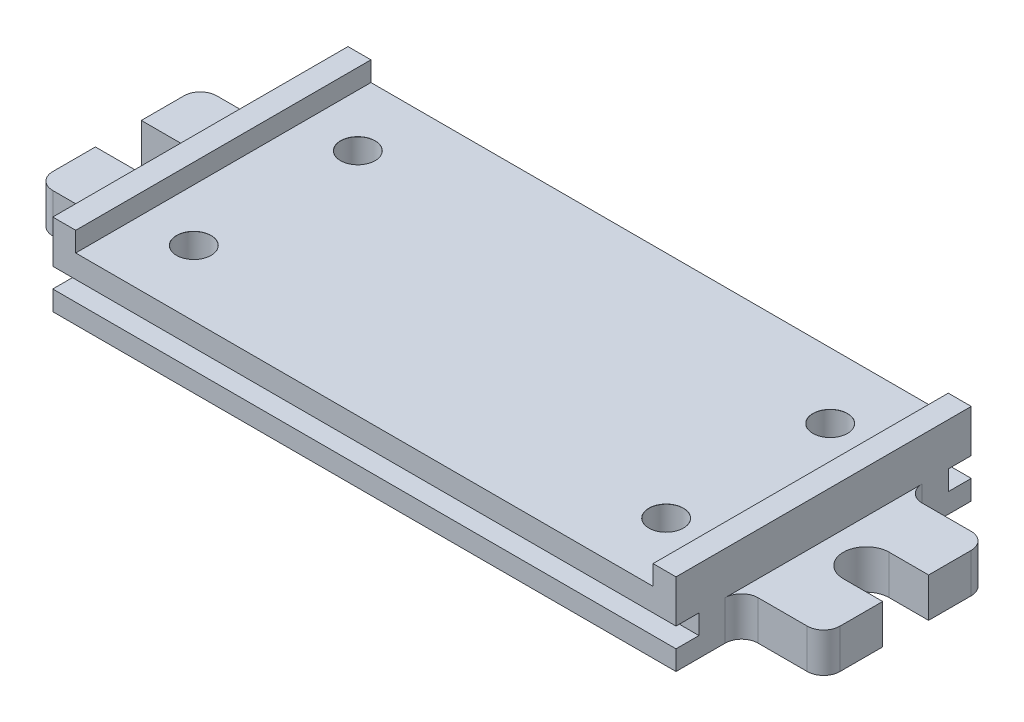
from build123d import *

# Parameters (mm, degrees)
SKETCH1_W                                = 190
SKETCH1_H                                = 90
BOSS_EXTRUDE1_DEPTH                      = 25
BOSS_EXTRUDE2_DEPTH                      = 12
SKETCH2_W                                = 7
SKETCH2_H                                = 6
CUT_EXTRUDE1_DEPTH                       = 222.076909694
SKETCH3_W                                = 176
SKETCH3_H                                = 6
CUT_EXTRUDE2_DEPTH                       = 153.069063257
CUT_EXTRUDE3_DEPTH                       = 6
HOLE_FOR_M8_300_SC_NUTS_SP_1_D           = 10.5
HOLE_FOR_M8_300_SC_NUTS_SP_1_CSINK_D     = 10.55
HOLE_FOR_M8_300_SC_NUTS_SP_1_CSINK_ANGLE = 90
SKETCH7_W                                = 1.329700855
SKETCH7_H                                = 7.408333333
BOSS_EXTRUDE3_DEPTH                      = 5


with BuildPart() as part:
    # Sketch1 → Boss-Extrude1 (new body)
    with BuildSketch(Plane(origin=(0, 0, 0), x_dir=(1, 0, 0), z_dir=(0, 1, 0))):
        Rectangle(SKETCH1_W, SKETCH1_H)
    extrude(amount=BOSS_EXTRUDE1_DEPTH)

    # Sketch1<3> → Boss-Extrude2 (add)
    with BuildSketch(Plane(origin=(0, 0, 0), x_dir=(1, 0, 0), z_dir=(0, 1, 0))):
        with BuildLine():
            ThreePointArc((-95, 30), (-96.464466094, 26.464466094), (-100, 25))
            Line((-100, 25), (-115, 25))
            ThreePointArc((-115, 25), (-118.535533906, 23.535533906), (-120, 20))
            Line((-120, 20), (-120, 7))
            Line((-120, 7), (-108, 7))
            ThreePointArc((-108, 7), (-101, 0), (-108, -7))
            Line((-108, -7), (-120, -7))
            Line((-120, -7), (-120, -20))
            ThreePointArc((-120, -20), (-118.535533906, -23.535533906), (-115, -25))
            Line((-115, -25), (-100, -25))
            ThreePointArc((-100, -25), (-96.464466094, -26.464466094), (-95, -30))
            Line((-95, -30), (-95, 30))
        make_face()
        with BuildLine():
            ThreePointArc((100, 25), (96.464466094, 26.464466094), (95, 30))
            Line((95, 30), (95, -30))
            ThreePointArc((95, -30), (96.464466094, -26.464466094), (100, -25))
            Line((100, -25), (115, -25))
            ThreePointArc((115, -25), (118.535533906, -23.535533906), (120, -20))
            Line((120, -20), (120, -7))
            Line((120, -7), (108, -7))
            ThreePointArc((108, -7), (101, 0), (108, 7))
            Line((108, 7), (120, 7))
            Line((120, 7), (120, 20))
            ThreePointArc((120, 20), (118.535533906, 23.535533906), (115, 25))
            Line((115, 25), (100, 25))
        make_face()
    extrude(amount=BOSS_EXTRUDE2_DEPTH)

    # Sketch2 → Cut-Extrude1 (cut, through all)
    with BuildSketch(Plane.ZY.offset(95)):
        with Locations((-41.5, 9)):
            Rectangle(SKETCH2_W, SKETCH2_H)
        with Locations((41.5, 9)):
            Rectangle(SKETCH2_W, SKETCH2_H)
    extrude(amount=-CUT_EXTRUDE1_DEPTH, mode=Mode.SUBTRACT)

    # Sketch3 → Cut-Extrude2 (cut, through all)
    with BuildSketch(Plane(origin=(0, 0, -45), x_dir=(-1, 0, 0), z_dir=(0, 0, -1))):
        with Locations((0, 22)):
            Rectangle(SKETCH3_W, SKETCH3_H)
    extrude(amount=-CUT_EXTRUDE2_DEPTH, mode=Mode.SUBTRACT)

    # Sketch4 → Cut-Extrude3 (cut)
    with BuildSketch(Plane.XZ):
        with BuildLine():
            Line((-77, -30), (77, -30))
            ThreePointArc((77, -30), (80.535533906, -28.535533906), (82, -25))
            Line((82, -25), (82, 25))
            ThreePointArc((82, 25), (80.535533906, 28.535533906), (77, 30))
            Line((77, 30), (-77, 30))
            ThreePointArc((-77, 30), (-80.535533906, 28.535533906), (-82, 25))
            Line((-82, 25), (-82, -25))
            ThreePointArc((-82, -25), (-80.535533906, -28.535533906), (-77, -30))
        make_face()
    extrude(amount=-CUT_EXTRUDE3_DEPTH, mode=Mode.SUBTRACT)

    # Hole for M8 300® SC Nuts (SP)1 (through all)
    with Locations(Plane(origin=(0, 19, 0), x_dir=(1, 0, 0), z_dir=(0, 1, 0))):
        with Locations((-72, 25), (-72, -25), (72, -25), (72, 25)):
            CounterSinkHole(HOLE_FOR_M8_300_SC_NUTS_SP_1_D / 2, HOLE_FOR_M8_300_SC_NUTS_SP_1_CSINK_D / 2, counter_sink_angle=HOLE_FOR_M8_300_SC_NUTS_SP_1_CSINK_ANGLE)

    # Sketch7 → Boss-Extrude3 (add)
    # profile 1 of 26: a face of its own
    with BuildSketch(Plane.XZ.offset(-6)):
        Polygon((-51.969907661, 7.742094723), (-50.733701398, 7.742094723), (-47.741874475, 0.33376139), (-49.162101839, 0.33376139), (-49.737909798, 1.853419509), (-52.962731179, 1.853419509), (-53.54002318, 0.33376139), (-54.960250543, 0.33376139), align=None)
        Polygon((-51.351062509, 5.754963646), (-52.458157194, 3.183120364), (-50.242483783, 3.183120364), align=None, mode=Mode.SUBTRACT)
    # profile 2 of 26: a face of its own
    with BuildSketch(Plane.XZ.offset(-6)):
        Polygon((-46.649620201, 7.742094723), (-45.319919347, 7.742094723), (-45.319919347, 5.134634453), (-43.218517103, 7.742094723), (-41.540066582, 7.742094723), (-44.180175757, 4.465331902), (-41.283327466, 0.33376139), (-42.884607848, 0.33376139), (-45.319919347, 3.807901681), (-45.319919347, 0.33376139), (-46.649620201, 0.33376139), align=None)
    # profile 3 of 26: a face of its own
    with BuildSketch(Plane.XZ.offset(-6)):
        Polygon((-38.008048687, 7.742094723), (-36.771842424, 7.742094723), (-33.780015501, 0.33376139), (-35.200242864, 0.33376139), (-35.776050824, 1.853419509), (-39.000872205, 1.853419509), (-39.578164205, 0.33376139), (-40.998391569, 0.33376139), align=None)
        Polygon((-37.389203535, 5.754963646), (-38.49629822, 3.183120364), (-36.280624809, 3.183120364), align=None, mode=Mode.SUBTRACT)
    # profile 4 of 26: a face of its own
    with BuildSketch(Plane.XZ.offset(-6)):
        with BuildLine():
            Line((-28.888615928, 6.752239287), (-29.882923487, 5.842522073))
            add(Edge.make_bspline(
                [(-29.882923487, 5.842522073), (-29.925515359, 5.902602337), (-30.007285814, 6.017948065), (-30.139827193, 6.172398714), (-30.27177008, 6.304156611), (-30.404336845, 6.412671333), (-30.53870251, 6.497283573), (-30.674633835, 6.557189974), (-30.811360188, 6.595273041), (-30.903219192, 6.600015299), (-30.94846502, 6.602351133)],
                knots=[0, 0, 0, 0, 1.299362458, 2.494594718, 3.587462134, 4.587049575, 5.512617175, 6.380583204, 7.202344345, 8, 8, 8, 8], degree=3))
            add(Edge.make_bspline(
                [(-30.94846502, 6.602351133), (-30.99066903, 6.600871041), (-31.072153886, 6.598013373), (-31.188316594, 6.569608365), (-31.291447499, 6.520585492), (-31.381445953, 6.456483962), (-31.452738006, 6.379256479), (-31.509659182, 6.298264706), (-31.541710587, 6.208868106), (-31.545929182, 6.147466915), (-31.548017637, 6.117069683)],
                knots=[0, 0, 0, 0, 1.185010067, 2.2879431, 3.333075148, 4.379039566, 5.372662701, 6.27520591, 7.14612461, 8, 8, 8, 8], degree=3))
            add(Edge.make_bspline(
                [(-31.548017637, 6.117069683), (-31.546708908, 6.086234109), (-31.54407331, 6.024135549), (-31.51861702, 5.933122375), (-31.480247122, 5.84419191), (-31.443583117, 5.790055704), (-31.424842223, 5.762383852)],
                knots=[0, 0, 0, 0, 0.967525499, 1.948461899, 2.951351359, 4, 4, 4, 4], degree=3))
            add(Edge.make_bspline(
                [(-31.424842223, 5.762383852), (-31.407804723, 5.740874811), (-31.368586648, 5.691363839), (-31.293805812, 5.612946178), (-31.199896786, 5.516877678), (-31.083245755, 5.406461855), (-30.948695222, 5.277727723), (-30.790008598, 5.135735871), (-30.611753575, 4.976088975), (-30.485054035, 4.864916657), (-30.418662336, 4.806661363)],
                knots=[0, 0, 0, 0, 0.473873513, 1.090794244, 1.870441696, 2.795289791, 3.865433203, 5.087734844, 6.473946851, 8, 8, 8, 8], degree=3))
            add(Edge.make_bspline(
                [(-30.418662336, 4.806661363), (-30.356344175, 4.752728139), (-30.238077254, 4.650374084), (-30.069806912, 4.505098937), (-29.921925305, 4.37439843), (-29.792278138, 4.260234097), (-29.682830735, 4.161408094), (-29.593122978, 4.077448033), (-29.522059239, 4.009988461), (-29.481663665, 3.969242839), (-29.464423887, 3.951853671)],
                knots=[0, 0, 0, 0, 1.543621617, 2.929473131, 4.163658386, 5.240097082, 6.164993805, 6.925417477, 7.541396219, 8, 8, 8, 8], degree=3))
            add(Edge.make_bspline(
                [(-29.464423887, 3.951853671), (-29.399019767, 3.881072405), (-29.273290078, 3.745005954), (-29.109885806, 3.534145749), (-28.975398804, 3.328303192), (-28.871357109, 3.123605024), (-28.792780637, 2.917097857), (-28.737383183, 2.703717114), (-28.704205279, 2.481233099), (-28.700521757, 2.329414919), (-28.698658663, 2.252626574)],
                knots=[0, 0, 0, 0, 1.206664779, 2.319633467, 3.337109185, 4.282041471, 5.190008762, 6.099243693, 7.03861361, 8, 8, 8, 8], degree=3))
            add(Edge.make_bspline(
                [(-28.698658663, 2.252626574), (-28.699984766, 2.177805748), (-28.702586628, 2.031004504), (-28.734454458, 1.816182751), (-28.779896113, 1.610589009), (-28.850156884, 1.41646043), (-28.935790295, 1.230610452), (-29.043144143, 1.055934026), (-29.169216518, 0.890663357), (-29.313714817, 0.737752859), (-29.473547094, 0.598997181), (-29.644982401, 0.475473599), (-29.829697119, 0.373489148), (-30.026113075, 0.289512227), (-30.234125131, 0.22483208), (-30.453485483, 0.177027423), (-30.684529657, 0.148335821), (-30.842520992, 0.145336455), (-30.923236321, 0.143804125)],
                knots=[0, 0, 0, 0, 1.043214005, 2.046824704, 3.02475056, 3.976699089, 4.921714032, 5.875962561, 6.831408892, 7.817874052, 8.806269674, 9.781291748, 10.760897367, 11.74438705, 12.757449933, 13.795994037, 14.874007457, 16, 16, 16, 16], degree=3))
            add(Edge.make_bspline(
                [(-30.923236321, 0.143804125), (-30.986597166, 0.144928188), (-31.112087978, 0.147154479), (-31.297042463, 0.165330288), (-31.475636925, 0.194664111), (-31.647670196, 0.236708243), (-31.813917314, 0.289983859), (-31.974385107, 0.355057984), (-32.127965814, 0.432939241), (-32.275821497, 0.522026083), (-32.417233397, 0.625467641), (-32.553989611, 0.741149087), (-32.684731747, 0.870849653), (-32.810087732, 1.014262602), (-32.929255503, 1.171794045), (-33.046135851, 1.341250066), (-33.15553426, 1.525775537), (-33.223114524, 1.655221648), (-33.257633022, 1.721339848)],
                knots=[0, 0, 0, 0, 1.016823716, 2.013894106, 2.979844003, 3.91962641, 4.853723003, 5.779685073, 6.695824784, 7.614987388, 8.547259901, 9.504950863, 10.487499108, 11.500346958, 12.559593716, 13.656357062, 14.802919212, 16, 16, 16, 16], degree=3))
            Line((-33.257633022, 1.721339848), (-32.08820861, 2.423291304))
            add(Edge.make_bspline(
                [(-32.08820861, 2.423291304), (-32.045031127, 2.348238508), (-31.962256203, 2.204355884), (-31.821986356, 2.011031343), (-31.678287058, 1.845480874), (-31.527836111, 1.710630593), (-31.372462942, 1.604677379), (-31.211417062, 1.528955861), (-31.044585324, 1.482084327), (-30.930947124, 1.476360231), (-30.874262963, 1.473504979)],
                knots=[0, 0, 0, 0, 1.283663364, 2.460892379, 3.537111102, 4.529833553, 5.449777664, 6.316464042, 7.160231139, 8, 8, 8, 8], degree=3))
            add(Edge.make_bspline(
                [(-30.874262963, 1.473504979), (-30.816607057, 1.475836732), (-30.704746201, 1.480360673), (-30.545079144, 1.522146948), (-30.39869034, 1.587754464), (-30.272152939, 1.681367344), (-30.165009046, 1.789410835), (-30.085930703, 1.909614159), (-30.036253155, 2.039671254), (-30.031001034, 2.130017467), (-30.028359518, 2.175456435)],
                knots=[0, 0, 0, 0, 1.13588714, 2.203786484, 3.234766741, 4.283437687, 5.291419208, 6.222934724, 7.106237994, 8, 8, 8, 8], degree=3))
            add(Edge.make_bspline(
                [(-30.028359518, 2.175456435), (-30.03079885, 2.217730001), (-30.035754119, 2.303604702), (-30.072253106, 2.431286575), (-30.129312155, 2.55891038), (-30.196817034, 2.663590878), (-30.265511701, 2.751237021), (-30.331199297, 2.82717844), (-30.411189412, 2.911080412), (-30.505279226, 3.003048481), (-30.612225569, 3.103892265), (-30.732118528, 3.213601888), (-30.866331004, 3.33121094), (-30.961192647, 3.411325064), (-31.010794747, 3.45321585)],
                knots=[0, 0, 0, 0, 0.916159276, 1.861089862, 2.860218735, 3.940849679, 4.552606315, 5.27541173, 6.11797699, 7.06649574, 8.129236253, 9.306560635, 10.591630461, 12, 12, 12, 12], degree=3))
            add(Edge.make_bspline(
                [(-31.010794747, 3.45321585), (-31.105090314, 3.532998941), (-31.286072046, 3.686126842), (-31.541822196, 3.912291931), (-31.772275981, 4.123663929), (-31.975442954, 4.322855858), (-32.153911776, 4.506189103), (-32.306473781, 4.675152768), (-32.431453003, 4.831050176), (-32.562966686, 5.015700223), (-32.68793098, 5.240708993), (-32.795935591, 5.511420627), (-32.866004424, 5.782097913), (-32.873854662, 5.963815733), (-32.877718492, 6.053255914)],
                knots=[0, 0, 0, 0, 1.345494975, 2.582412109, 3.71882943, 4.751509156, 5.681369928, 6.505683931, 7.230279997, 7.856715994, 8.973648664, 10.023341002, 11.027102913, 12, 12, 12, 12], degree=3))
            add(Edge.make_bspline(
                [(-32.877718492, 6.053255914), (-32.87611153, 6.11668209), (-32.872945643, 6.241638469), (-32.844705442, 6.425368618), (-32.802499386, 6.602652774), (-32.741204074, 6.772844124), (-32.661650162, 6.935729497), (-32.565035025, 7.092106284), (-32.449858414, 7.240535229), (-32.320062149, 7.380917934), (-32.177059896, 7.509211751), (-32.024243817, 7.6224439), (-31.862478862, 7.71808142), (-31.692754629, 7.797419686), (-31.514019406, 7.85814809), (-31.327589929, 7.901195409), (-31.133198798, 7.926798581), (-31.000978146, 7.930279036), (-30.933624609, 7.932051988)],
                knots=[0, 0, 0, 0, 1.010766082, 1.991317756, 2.957454644, 3.913069143, 4.869106762, 5.843196583, 6.838735724, 7.860187025, 8.887984031, 9.89767229, 10.887916223, 11.879572884, 12.879850636, 13.892031539, 14.926195476, 16, 16, 16, 16], degree=3))
            add(Edge.make_bspline(
                [(-30.933624609, 7.932051988), (-30.846337757, 7.928858849), (-30.672453066, 7.922497776), (-30.415359535, 7.872756268), (-30.164241322, 7.794532507), (-29.961885561, 7.700164146), (-29.800874858, 7.608749469), (-29.677475196, 7.52458635), (-29.551909396, 7.428172974), (-29.423164851, 7.319205517), (-29.293633831, 7.195630888), (-29.159633152, 7.060390879), (-29.022988737, 6.912316701), (-28.934191532, 6.806533194), (-28.888615928, 6.752239287)],
                knots=[0, 0, 0, 0, 1.282922637, 2.555718331, 3.837320111, 5.142675274, 5.830281639, 6.55870424, 7.337177975, 8.157850921, 9.037902056, 9.96903443, 10.957596896, 12, 12, 12, 12], degree=3))
        make_face()
    # profile 5 of 26: a face of its own
    with BuildSketch(Plane.XZ.offset(-6)):
        Polygon((-27.368957808, 7.742094723), (-26.039256954, 7.742094723), (-26.039256954, 4.892735749), (-23.474833877, 4.892735749), (-23.474833877, 7.742094723), (-22.145133022, 7.742094723), (-22.145133022, 0.33376139), (-23.474833877, 0.33376139), (-23.474833877, 3.563034894), (-26.039256954, 3.563034894), (-26.039256954, 0.33376139), (-27.368957808, 0.33376139), align=None)
    # profile 6 of 26: a face of its own
    with BuildSketch(Plane.XZ.offset(-6)):
        with BuildLine():
            Line((-20.435517637, 7.742094723), (-18.760035199, 7.742094723))
            add(Edge.make_bspline(
                [(-18.760035199, 7.742094723), (-18.629412071, 7.741181623), (-18.376916089, 7.739416589), (-18.011099363, 7.719528908), (-17.670936358, 7.688943067), (-17.3562078, 7.646866699), (-17.067558932, 7.591188142), (-16.805361961, 7.521350305), (-16.568736892, 7.44073414), (-16.35508918, 7.345872864), (-16.160049368, 7.235274037), (-15.974852841, 7.112075822), (-15.79986323, 6.971765111), (-15.63262483, 6.817048774), (-15.475295891, 6.645096326), (-15.32525632, 6.458755921), (-15.186179767, 6.255325366), (-15.05386225, 6.039682285), (-14.934198662, 5.810912803), (-14.82982361, 5.570964157), (-14.742387995, 5.321380508), (-14.671342031, 5.061895863), (-14.614710198, 4.793371632), (-14.575086045, 4.51526596), (-14.55059, 4.227836325), (-14.548105081, 4.033031148), (-14.546842424, 3.934045177)],
                knots=[0, 0, 0, 0, 1.44355588, 2.790409838, 4.047694926, 5.217575253, 6.298404546, 7.294384826, 8.214239204, 9.058592145, 9.873746385, 10.689560431, 11.514393297, 12.350027578, 13.205127629, 14.088021785, 14.991911688, 15.926770944, 16.882954281, 17.842803888, 18.816321264, 19.80318086, 20.814351908, 21.847355356, 22.906180909, 24, 24, 24, 24], degree=3))
            add(Edge.make_bspline(
                [(-14.546842424, 3.934045177), (-14.550148741, 3.794369528), (-14.556657421, 3.519409837), (-14.611482906, 3.115909659), (-14.700154277, 2.729114494), (-14.82483428, 2.362050003), (-14.979404107, 2.017984951), (-15.164055074, 1.702986779), (-15.376079767, 1.418746239), (-15.613008088, 1.166678616), (-15.869543754, 0.950023077), (-16.136136043, 0.764473463), (-16.415382048, 0.61815211), (-16.661436805, 0.525362491), (-16.874796975, 0.467655376), (-17.062124897, 0.433549915), (-17.274910303, 0.40227315), (-17.515137231, 0.37810314), (-17.781751858, 0.35654943), (-18.075816914, 0.344837983), (-18.3963803, 0.335107509), (-18.619041881, 0.334221853), (-18.7348065, 0.33376139)],
                knots=[0, 0, 0, 0, 1.315458931, 2.589557908, 3.828601765, 5.048913369, 6.235739168, 7.376350998, 8.481830359, 9.569842114, 10.627874879, 11.640079404, 12.624025415, 13.590060155, 14.111227486, 14.704434459, 15.382649715, 16.137166398, 16.978595427, 17.902333227, 18.909396075, 20, 20, 20, 20], degree=3))
            Line((-18.7348065, 0.33376139), (-20.435517637, 0.33376139))
            Line((-20.435517637, 0.33376139), (-20.435517637, 7.742094723))
        make_face()
        with BuildLine():
            Line((-19.105816783, 6.412393868), (-19.105816783, 1.663462244))
            Line((-19.105816783, 1.663462244), (-18.411285533, 1.663462244))
            add(Edge.make_bspline(
                [(-18.411285533, 1.663462244), (-18.32864698, 1.663613672), (-18.169705533, 1.663904919), (-17.940230062, 1.677777243), (-17.728023437, 1.69170123), (-17.533669812, 1.718129424), (-17.355754743, 1.747568573), (-17.196722317, 1.788537179), (-17.053294183, 1.83157123), (-16.927222291, 1.886358909), (-16.811750709, 1.948026089), (-16.704837214, 2.02027634), (-16.601635758, 2.100507518), (-16.504075775, 2.191079338), (-16.411788024, 2.290792457), (-16.325318539, 2.400160653), (-16.243513179, 2.518850242), (-16.168471735, 2.647488763), (-16.099898461, 2.784717765), (-16.039066284, 2.929207986), (-15.988627432, 3.082162717), (-15.946705746, 3.242150119), (-15.916747948, 3.410563063), (-15.891963584, 3.586154138), (-15.879186523, 3.76961902), (-15.877432951, 3.894454658), (-15.876543278, 3.957789835)],
                knots=[0, 0, 0, 0, 1.50275155, 2.890291501, 4.180787663, 5.369391935, 6.45668281, 7.458360028, 8.354766181, 9.177074746, 9.954075863, 10.732690366, 11.5210699, 12.329727389, 13.151100085, 13.990027547, 14.863562427, 15.770965086, 16.696477834, 17.652329173, 18.619756807, 19.62365428, 20.657822005, 21.729286259, 22.847956731, 24, 24, 24, 24], degree=3))
            add(Edge.make_bspline(
                [(-15.876543278, 3.957789835), (-15.878315203, 4.054845006), (-15.88177032, 4.24409507), (-15.915090715, 4.519741918), (-15.969329963, 4.77930472), (-16.046724143, 5.021820167), (-16.144281906, 5.247969857), (-16.266398188, 5.455837821), (-16.407817574, 5.648915955), (-16.519648166, 5.762181784), (-16.575526652, 5.818777415)],
                knots=[0, 0, 0, 0, 1.13821349, 2.219428113, 3.251817212, 4.244760574, 5.201143372, 6.134805572, 7.068016741, 8, 8, 8, 8], degree=3))
            add(Edge.make_bspline(
                [(-16.575526652, 5.818777415), (-16.630628129, 5.867004544), (-16.743166658, 5.965502994), (-16.940747333, 6.083529327), (-17.158471003, 6.187227028), (-17.401318535, 6.269447741), (-17.666942913, 6.334471386), (-17.956926202, 6.379316604), (-18.26971548, 6.408133665), (-18.486408604, 6.410943377), (-18.598274715, 6.412393868)],
                knots=[0, 0, 0, 0, 0.813307809, 1.661089106, 2.549956539, 3.493439533, 4.508053171, 5.589449661, 6.755572447, 8, 8, 8, 8], degree=3))
            Line((-18.598274715, 6.412393868), (-19.105816783, 6.412393868))
        make_face(mode=Mode.SUBTRACT)
    # profile 7 of 26: a face of its own
    with BuildSketch(Plane.XZ.offset(-6)):
        with Locations((-12.742248406, 4.037928057)):
            Rectangle(SKETCH7_W, SKETCH7_H)
    # profile 8 of 26: a face of its own
    with BuildSketch(Plane.XZ.offset(-6)):
        with BuildLine():
            Line((-10.367782595, 7.742094723), (-8.883741462, 7.742094723))
            add(Edge.make_bspline(
                [(-8.883741462, 7.742094723), (-8.78677614, 7.741660685), (-8.599709708, 7.740823336), (-8.329944522, 7.730669364), (-8.08107293, 7.712472827), (-7.853152109, 7.689984784), (-7.646275775, 7.658457424), (-7.460184856, 7.622313774), (-7.294840735, 7.578280289), (-7.14837891, 7.526013152), (-7.016934152, 7.46439224), (-6.892545017, 7.398761571), (-6.778022712, 7.320433681), (-6.667586951, 7.237850419), (-6.567551536, 7.143122637), (-6.47167566, 7.042554606), (-6.384019926, 6.932157882), (-6.304178172, 6.813268786), (-6.231749399, 6.688083881), (-6.168470777, 6.556379374), (-6.117142702, 6.417946855), (-6.07408483, 6.273681826), (-6.039500328, 6.123590574), (-6.016479782, 5.966750025), (-6.000843069, 5.804255299), (-5.999463345, 5.693661286), (-5.998765501, 5.637724397)],
                knots=[0, 0, 0, 0, 1.698747864, 3.27724071, 4.728299578, 6.070144658, 7.288476769, 8.393259625, 9.389771311, 10.283485332, 11.113357557, 11.931608583, 12.74405601, 13.541433047, 14.344816069, 15.154114104, 15.974336324, 16.810834471, 17.661136416, 18.50621059, 19.367396281, 20.244825668, 21.142564693, 22.063065223, 23.020325768, 24, 24, 24, 24], degree=3))
            add(Edge.make_bspline(
                [(-5.998765501, 5.637724397), (-5.999775195, 5.575842749), (-6.001759368, 5.454237706), (-6.021210659, 5.275979633), (-6.05443961, 5.106026699), (-6.09786811, 4.942945661), (-6.158426065, 4.789419564), (-6.227610686, 4.641785228), (-6.312729713, 4.504181867), (-6.40999181, 4.374888228), (-6.516213116, 4.252853092), (-6.63391532, 4.141599994), (-6.760854967, 4.040370526), (-6.89629725, 3.948103794), (-7.040750659, 3.86498592), (-7.194110965, 3.790238596), (-7.357425398, 3.72625247), (-7.471152655, 3.692788245), (-7.528811908, 3.67582202)],
                knots=[0, 0, 0, 0, 1.102006807, 2.165578795, 3.188629044, 4.184801286, 5.166646146, 6.124351954, 7.085497154, 8.042432466, 9.003981491, 9.963833307, 10.922997304, 11.89326795, 12.880200226, 13.889073926, 14.929769137, 16, 16, 16, 16], degree=3))
            add(Edge.make_bspline(
                [(-7.528811908, 3.67582202), (-7.566789609, 3.666373106), (-7.649061539, 3.645903717), (-7.785198985, 3.625122149), (-7.942083099, 3.606014776), (-8.120221188, 3.589594301), (-8.319715954, 3.578432204), (-8.540374233, 3.569715103), (-8.782296025, 3.563376871), (-8.950518872, 3.563151962), (-9.03808174, 3.563034894)],
                knots=[0, 0, 0, 0, 0.618981996, 1.340914327, 2.176866532, 3.120127938, 4.170906482, 5.338178032, 6.614476169, 8, 8, 8, 8], degree=3))
            Line((-9.03808174, 3.563034894), (-9.03808174, 0.33376139))
            Line((-9.03808174, 0.33376139), (-10.367782595, 0.33376139))
            Line((-10.367782595, 0.33376139), (-10.367782595, 7.742094723))
        make_face()
        with BuildLine():
            Line((-9.03808174, 4.892735749), (-8.567640701, 4.892735749))
            add(Edge.make_bspline(
                [(-8.567640701, 4.892735749), (-8.482036527, 4.893278545), (-8.324523574, 4.8942773), (-8.109416504, 4.908719869), (-7.936552325, 4.930776588), (-7.799986414, 4.962411026), (-7.692154691, 5.010420473), (-7.599156582, 5.065958363), (-7.519389729, 5.1361845), (-7.450323375, 5.216429877), (-7.395106907, 5.308635838), (-7.356817162, 5.411300987), (-7.331944896, 5.52226822), (-7.329647712, 5.599494069), (-7.328466355, 5.639208438)],
                knots=[0, 0, 0, 0, 1.8619151, 3.425951444, 4.686033666, 5.651700536, 6.461346321, 7.243864085, 7.999046032, 8.762387399, 9.539336099, 10.322741239, 11.137448474, 12, 12, 12, 12], degree=3))
            add(Edge.make_bspline(
                [(-7.328466355, 5.639208438), (-7.32963556, 5.673906365), (-7.331904097, 5.741228687), (-7.348569393, 5.838391496), (-7.375129081, 5.928967277), (-7.413613047, 6.012010087), (-7.463363702, 6.087378823), (-7.524019819, 6.155043794), (-7.594803061, 6.216454103), (-7.649451861, 6.248959517), (-7.677216021, 6.265473796)],
                knots=[0, 0, 0, 0, 1.102301479, 2.1387299, 3.123554645, 4.094223062, 5.036071848, 5.982632524, 6.975082478, 8, 8, 8, 8], degree=3))
            add(Edge.make_bspline(
                [(-7.677216021, 6.265473796), (-7.700733868, 6.277367445), (-7.750525967, 6.302548738), (-7.835326741, 6.331823832), (-7.933185538, 6.356520598), (-8.044763017, 6.377018676), (-8.169614062, 6.392927313), (-8.307716399, 6.405093441), (-8.459273258, 6.409985915), (-8.564671984, 6.411569079), (-8.619582141, 6.412393868)],
                knots=[0, 0, 0, 0, 0.656809284, 1.390599849, 2.23162475, 3.173112763, 4.218524733, 5.370385145, 6.63003504, 8, 8, 8, 8], degree=3))
            Line((-8.619582141, 6.412393868), (-9.03808174, 6.412393868))
            Line((-9.03808174, 6.412393868), (-9.03808174, 4.892735749))
        make_face(mode=Mode.SUBTRACT)
    # profile 9 of 26: a face of its own
    with BuildSketch(Plane.XZ.offset(-6)):
        Polygon((-1.233509424, 7.742094723), (0.143680747, 7.742094723), (1.836971679, 2.5746635), (3.539166858, 7.742094723), (4.905968741, 7.742094723), (6.158499457, 0.33376139), (4.81247415, 0.33376139), (4.021480226, 5.01294308), (2.48104553, 0.33376139), (1.185477622, 0.33376139), (-0.347536868, 5.01294308), (-1.137046751, 0.33376139), (-2.484556099, 0.33376139), align=None)
    # profile 10 of 26: a face of its own
    with BuildSketch(Plane.XZ.offset(-6)):
        Polygon((9.671224817, 7.742094723), (10.907431081, 7.742094723), (13.899258004, 0.33376139), (12.47903064, 0.33376139), (11.90322268, 1.853419509), (8.6784013, 1.853419509), (8.101109299, 0.33376139), (6.680881935, 0.33376139), align=None)
        Polygon((10.290069969, 5.754963646), (9.182975285, 3.183120364), (11.398648695, 3.183120364), align=None, mode=Mode.SUBTRACT)
    # profile 11 of 26: a face of its own
    with BuildSketch(Plane.XZ.offset(-6)):
        Polygon((14.991512277, 7.742094723), (16.321213132, 7.742094723), (16.321213132, 4.892735749), (18.885636209, 4.892735749), (18.885636209, 7.742094723), (20.215337063, 7.742094723), (20.215337063, 0.33376139), (18.885636209, 0.33376139), (18.885636209, 3.563034894), (16.321213132, 3.563034894), (16.321213132, 0.33376139), (14.991512277, 0.33376139), align=None)
    # profile 12 of 26: a face of its own
    with BuildSketch(Plane.XZ.offset(-6)):
        Polygon((24.202955586, 7.742094723), (25.43916185, 7.742094723), (28.430988773, 0.33376139), (27.010761409, 0.33376139), (26.43495345, 1.853419509), (23.210132069, 1.853419509), (22.632840068, 0.33376139), (21.212612705, 0.33376139), align=None)
        Polygon((24.821800739, 5.754963646), (23.714706054, 3.183120364), (25.930379465, 3.183120364), align=None, mode=Mode.SUBTRACT)
    # profile 13 of 26: a face of its own
    with BuildSketch(Plane.XZ.offset(-6)):
        with BuildLine():
            Line((29.523243046, 7.742094723), (31.007284179, 7.742094723))
            add(Edge.make_bspline(
                [(31.007284179, 7.742094723), (31.104249501, 7.741660685), (31.291315933, 7.740823336), (31.561081119, 7.730669364), (31.809952711, 7.712472827), (32.037873532, 7.689984784), (32.244749866, 7.658457424), (32.430840785, 7.622313774), (32.596184906, 7.578280289), (32.742646732, 7.526013152), (32.874091489, 7.46439224), (32.998480624, 7.398761571), (33.113002929, 7.320433681), (33.22343869, 7.237850419), (33.323474105, 7.143122637), (33.419349982, 7.042554606), (33.507005715, 6.932157882), (33.586847469, 6.813268786), (33.659276242, 6.688083881), (33.722554864, 6.556379374), (33.773882939, 6.417946855), (33.816940811, 6.273681826), (33.851525313, 6.123590574), (33.874545859, 5.966750025), (33.890182572, 5.804255299), (33.891562296, 5.693661286), (33.89226014, 5.637724397)],
                knots=[0, 0, 0, 0, 1.698747864, 3.27724071, 4.728299578, 6.070144658, 7.288476769, 8.393259625, 9.389771311, 10.283485332, 11.113357557, 11.931608583, 12.74405601, 13.541433047, 14.344816069, 15.154114104, 15.974336324, 16.810834471, 17.661136416, 18.50621059, 19.367396281, 20.244825668, 21.142564693, 22.063065223, 23.020325768, 24, 24, 24, 24], degree=3))
            add(Edge.make_bspline(
                [(33.89226014, 5.637724397), (33.891250446, 5.575842749), (33.889266273, 5.454237706), (33.869814982, 5.275979633), (33.836586031, 5.106026699), (33.793157531, 4.942945661), (33.732599576, 4.789419564), (33.663414955, 4.641785228), (33.578295928, 4.504181867), (33.481033831, 4.374888228), (33.374812525, 4.252853092), (33.257110322, 4.141599994), (33.130170674, 4.040370526), (32.994728391, 3.948103794), (32.850274982, 3.86498592), (32.696914676, 3.790238596), (32.533600243, 3.72625247), (32.419872986, 3.692788245), (32.362213733, 3.67582202)],
                knots=[0, 0, 0, 0, 1.102006807, 2.165578795, 3.188629044, 4.184801286, 5.166646146, 6.124351954, 7.085497154, 8.042432466, 9.003981491, 9.963833307, 10.922997304, 11.89326795, 12.880200226, 13.889073926, 14.929769137, 16, 16, 16, 16], degree=3))
            add(Edge.make_bspline(
                [(32.362213733, 3.67582202), (32.324236032, 3.666373106), (32.241964102, 3.645903717), (32.105826656, 3.625122149), (31.948942542, 3.606014776), (31.770804453, 3.589594301), (31.571309687, 3.578432204), (31.350651408, 3.569715103), (31.108729616, 3.563376871), (30.940506769, 3.563151962), (30.852943901, 3.563034894)],
                knots=[0, 0, 0, 0, 0.618981996, 1.340914327, 2.176866532, 3.120127938, 4.170906482, 5.338178032, 6.614476169, 8, 8, 8, 8], degree=3))
            Line((30.852943901, 3.563034894), (30.852943901, 0.33376139))
            Line((30.852943901, 0.33376139), (29.523243046, 0.33376139))
            Line((29.523243046, 0.33376139), (29.523243046, 7.742094723))
        make_face()
        with BuildLine():
            Line((30.852943901, 4.892735749), (31.32338494, 4.892735749))
            add(Edge.make_bspline(
                [(31.32338494, 4.892735749), (31.408989114, 4.893278545), (31.566502067, 4.8942773), (31.781609137, 4.908719869), (31.954473316, 4.930776588), (32.091039227, 4.962411026), (32.19887095, 5.010420473), (32.291869059, 5.065958363), (32.371635912, 5.1361845), (32.440702266, 5.216429877), (32.495918734, 5.308635838), (32.534208479, 5.411300987), (32.559080745, 5.52226822), (32.561377929, 5.599494069), (32.562559286, 5.639208438)],
                knots=[0, 0, 0, 0, 1.8619151, 3.425951444, 4.686033666, 5.651700536, 6.461346321, 7.243864085, 7.999046032, 8.762387399, 9.539336099, 10.322741239, 11.137448474, 12, 12, 12, 12], degree=3))
            add(Edge.make_bspline(
                [(32.562559286, 5.639208438), (32.561390081, 5.673906365), (32.559121544, 5.741228687), (32.542456248, 5.838391496), (32.51589656, 5.928967277), (32.477412594, 6.012010087), (32.427661939, 6.087378823), (32.367005822, 6.155043794), (32.29622258, 6.216454103), (32.24157378, 6.248959517), (32.21380962, 6.265473796)],
                knots=[0, 0, 0, 0, 1.102301479, 2.1387299, 3.123554645, 4.094223062, 5.036071848, 5.982632524, 6.975082478, 8, 8, 8, 8], degree=3))
            add(Edge.make_bspline(
                [(32.21380962, 6.265473796), (32.190291773, 6.277367445), (32.140499674, 6.302548738), (32.0556989, 6.331823832), (31.957840103, 6.356520598), (31.846262624, 6.377018676), (31.721411579, 6.392927313), (31.583309242, 6.405093441), (31.431752383, 6.409985915), (31.326353657, 6.411569079), (31.2714435, 6.412393868)],
                knots=[0, 0, 0, 0, 0.656809284, 1.390599849, 2.23162475, 3.173112763, 4.218524733, 5.370385145, 6.63003504, 8, 8, 8, 8], degree=3))
            Line((31.2714435, 6.412393868), (30.852943901, 6.412393868))
            Line((30.852943901, 6.412393868), (30.852943901, 4.892735749))
        make_face(mode=Mode.SUBTRACT)
    # profile 14 of 26: a face of its own
    with BuildSketch(Plane.XZ.offset(-6)):
        Polygon((37.499964133, 7.742094723), (38.736170397, 7.742094723), (41.72799732, 0.33376139), (40.307769956, 0.33376139), (39.731961997, 1.853419509), (36.507140616, 1.853419509), (35.929848615, 0.33376139), (34.509621252, 0.33376139), align=None)
        Polygon((38.118809286, 5.754963646), (37.011714601, 3.183120364), (39.227388012, 3.183120364), align=None, mode=Mode.SUBTRACT)
    # profile 15 of 26: a face of its own
    with BuildSketch(Plane.XZ.offset(-6)):
        Polygon((42.060422534, 7.742094723), (46.049525098, 7.742094723), (46.049525098, 6.412393868), (44.719824243, 6.412393868), (44.719824243, 0.33376139), (43.390123388, 0.33376139), (43.390123388, 6.412393868), (42.060422534, 6.412393868), align=None)
    # profile 16 of 26: a face of its own
    with BuildSketch(Plane.XZ.offset(-6)):
        with BuildLine():
            Line((47.094290055, 7.742094723), (48.643628997, 7.742094723))
            add(Edge.make_bspline(
                [(48.643628997, 7.742094723), (48.74603983, 7.741731223), (48.943004708, 7.741032111), (49.227017305, 7.730001971), (49.487921933, 7.714652626), (49.726104886, 7.691229118), (49.941464264, 7.660172378), (50.134215908, 7.623561621), (50.304354185, 7.581835814), (50.453313976, 7.529842166), (50.587742821, 7.47119412), (50.713049193, 7.40380644), (50.831997539, 7.328429508), (50.943792816, 7.243079954), (51.049406551, 7.149293195), (51.149037992, 7.046974826), (51.241279253, 6.935257229), (51.325559174, 6.814846317), (51.402373537, 6.688176799), (51.470261324, 6.555074757), (51.525467785, 6.415447626), (51.574248611, 6.271313322), (51.60938386, 6.120611416), (51.633819912, 5.964809016), (51.651711033, 5.803357681), (51.652739686, 5.693674812), (51.653264414, 5.637724397)],
                knots=[0, 0, 0, 0, 1.749336639, 3.364467119, 4.854658419, 6.213483162, 7.451590619, 8.570285859, 9.5643256, 10.440900261, 11.26203566, 12.067320669, 12.869050712, 13.665104639, 14.467235401, 15.27997916, 16.102287765, 16.939272006, 17.78853747, 18.631303466, 19.488103222, 20.351255419, 21.228522269, 22.127379805, 23.044756219, 24, 24, 24, 24], degree=3))
            add(Edge.make_bspline(
                [(51.653264414, 5.637724397), (51.651901361, 5.579325016), (51.649228662, 5.464814475), (51.634832051, 5.296607828), (51.608519568, 5.135679475), (51.568665485, 4.982500592), (51.522858393, 4.835164691), (51.461946712, 4.69639021), (51.393201858, 4.564158877), (51.311555605, 4.440341153), (51.22195283, 4.322186799), (51.117746688, 4.214222748), (51.005688136, 4.110646339), (50.879477955, 4.017945248), (50.744679606, 3.929851362), (50.598614788, 3.850014842), (50.442236771, 3.776428779), (50.332295281, 3.735392108), (50.276074243, 3.714407089)],
                knots=[0, 0, 0, 0, 1.099860209, 2.156625411, 3.176576793, 4.16617041, 5.135385252, 6.078461593, 7.016046972, 7.938469504, 8.868247731, 9.803980173, 10.76021508, 11.73834243, 12.748633912, 13.790971185, 14.870363756, 16, 16, 16, 16], degree=3))
            Line((50.276074243, 3.714407089), (51.985689628, 0.33376139))
            Line((51.985689628, 0.33376139), (50.50758466, 0.33376139))
            Line((50.50758466, 0.33376139), (48.875139414, 3.563034894))
            Line((48.875139414, 3.563034894), (48.42399091, 3.563034894))
            Line((48.42399091, 3.563034894), (48.42399091, 0.33376139))
            Line((48.42399091, 0.33376139), (47.094290055, 0.33376139))
            Line((47.094290055, 0.33376139), (47.094290055, 7.742094723))
        make_face()
        with BuildLine():
            Line((48.42399091, 4.892735749), (48.941921265, 4.892735749))
            add(Edge.make_bspline(
                [(48.941921265, 4.892735749), (49.005242556, 4.893448915), (49.126489223, 4.894814477), (49.300857854, 4.901148517), (49.459226156, 4.916410424), (49.602274216, 4.935693272), (49.730721837, 4.957958106), (49.843423314, 4.989864964), (49.942115204, 5.02405397), (50.025628003, 5.066542036), (50.09697942, 5.114860182), (50.158586802, 5.169750798), (50.20954494, 5.233279695), (50.251486087, 5.303720434), (50.28411174, 5.381696046), (50.307925966, 5.466350533), (50.321234598, 5.558648221), (50.322765801, 5.622346194), (50.323563559, 5.655532891)],
                knots=[0, 0, 0, 0, 1.688639943, 3.233382647, 4.650958383, 5.928841754, 7.082724185, 8.122798841, 9.049171256, 9.863274652, 10.613301712, 11.341792392, 12.054588806, 12.776240173, 13.521029143, 14.301969904, 15.115324896, 16, 16, 16, 16], degree=3))
            add(Edge.make_bspline(
                [(50.323563559, 5.655532891), (50.322055324, 5.694795176), (50.319092676, 5.771918659), (50.289694002, 5.882949433), (50.242897663, 5.985716011), (50.178752699, 6.079754067), (50.097970456, 6.162194319), (50.00526646, 6.234866058), (49.898639933, 6.292329431), (49.799911792, 6.330231661), (49.710092262, 6.352908955), (49.629032969, 6.369807875), (49.53516582, 6.381784624), (49.42841995, 6.394488099), (49.309067458, 6.402725659), (49.176457802, 6.408737436), (49.030971835, 6.411197149), (48.929554298, 6.411983476), (48.876623455, 6.412393868)],
                knots=[0, 0, 0, 0, 1.020303359, 2.004196876, 2.966617323, 3.9489082, 4.950758222, 5.960522915, 7.003732012, 8.091992268, 8.70421221, 9.413913587, 10.24622431, 11.166358409, 12.212345909, 13.359657661, 14.621978493, 16, 16, 16, 16], degree=3))
            Line((48.876623455, 6.412393868), (48.42399091, 6.412393868))
            Line((48.42399091, 6.412393868), (48.42399091, 4.892735749))
        make_face(mode=Mode.SUBTRACT)
    # profile 17 of 26: a face of its own
    with BuildSketch(Plane.XZ.offset(-6)):
        Polygon((55.355947039, 7.742094723), (56.592153303, 7.742094723), (59.583980226, 0.33376139), (58.163752862, 0.33376139), (57.587944903, 1.853419509), (54.363123522, 1.853419509), (53.785831521, 0.33376139), (52.365604158, 0.33376139), align=None)
        Polygon((55.974792192, 5.754963646), (54.867697507, 3.183120364), (57.083370918, 3.183120364), align=None, mode=Mode.SUBTRACT)
    # profile 18 of 26: a face of its own
    with BuildSketch(Plane.XZ.offset(-6)):
        Polygon((-22.707156318, -6.941939782), (-21.435227065, -6.941939782), (-21.435227065, -13.821106449), (-22.052588176, -13.821106449), (-22.052588176, -7.647495338), (-23.110921509, -7.647495338), align=None)
    # profile 19 of 26: a face of its own
    with BuildSketch(Plane.XZ.offset(-6)):
        with BuildLine():
            Line((-17.995643731, -9.058606449), (-18.613004842, -9.058606449))
            add(Edge.make_bspline(
                [(-18.613004842, -9.058606449), (-18.608981212, -8.976703311), (-18.601078909, -8.815847728), (-18.564072354, -8.581319431), (-18.511120702, -8.35714744), (-18.436252856, -8.145131692), (-18.343273493, -7.943397561), (-18.231771975, -7.752746339), (-18.099704062, -7.573905324), (-17.94992154, -7.408532431), (-17.787241751, -7.256822098), (-17.611713053, -7.125812806), (-17.427262887, -7.015121764), (-17.234450854, -6.922584704), (-17.031101579, -6.853125078), (-16.819060391, -6.80158707), (-16.597395683, -6.770579038), (-16.44636845, -6.767246012), (-16.369558662, -6.765550893)],
                knots=[0, 0, 0, 0, 1.10065271, 2.161652631, 3.183658789, 4.190468796, 5.17591951, 6.163126047, 7.15150782, 8.156236427, 9.156009102, 10.134482811, 11.092018607, 12.041330605, 13.001268258, 13.972401359, 14.968799086, 16, 16, 16, 16], degree=3))
            add(Edge.make_bspline(
                [(-16.369558662, -6.765550893), (-16.294127471, -6.767316788), (-16.145907875, -6.770786708), (-15.929583607, -6.80058535), (-15.723646329, -6.847256745), (-15.528498588, -6.912737403), (-15.345697382, -7.000760128), (-15.17386947, -7.10649791), (-15.01096921, -7.228789507), (-14.864331353, -7.372768133), (-14.729680354, -7.526473058), (-14.613516279, -7.690566545), (-14.514037311, -7.860048153), (-14.431118431, -8.036210249), (-14.370078329, -8.22071152), (-14.323735923, -8.410865844), (-14.297541208, -8.608641514), (-14.293520977, -8.742503327), (-14.291477065, -8.810559574)],
                knots=[0, 0, 0, 0, 1.111607364, 2.184268762, 3.212621178, 4.221274766, 5.211760367, 6.196651075, 7.1921475, 8.207485113, 9.220403448, 10.201281604, 11.166441695, 12.114753415, 13.065576456, 14.026450734, 14.996634279, 16, 16, 16, 16], degree=3))
            add(Edge.make_bspline(
                [(-14.291477065, -8.810559574), (-14.294792125, -8.906376163), (-14.301364071, -9.096327896), (-14.358079268, -9.375827175), (-14.445704318, -9.646876286), (-14.551983569, -9.865002971), (-14.659338995, -10.039884935), (-14.754035236, -10.185164368), (-14.867349563, -10.340095813), (-14.998245193, -10.506239695), (-15.144747476, -10.684104224), (-15.307910829, -10.87376239), (-15.48898168, -11.073199859), (-15.616065797, -11.209418784), (-15.681917603, -11.280004018)],
                knots=[0, 0, 0, 0, 1.184203166, 2.347625244, 3.513805382, 4.700623107, 5.337941753, 6.051866363, 6.845199593, 7.711357327, 8.668078039, 9.695487809, 10.805859518, 12, 12, 12, 12], degree=3))
            Line((-15.681917603, -11.280004018), (-17.403087308, -13.115550893))
            Line((-17.403087308, -13.115550893), (-14.20328262, -13.115550893))
            Line((-14.20328262, -13.115550893), (-14.20328262, -13.821106449))
            Line((-14.20328262, -13.821106449), (-18.877588176, -13.821106449))
            Line((-18.877588176, -13.821106449), (-16.209706231, -10.974079539))
            add(Edge.make_bspline(
                [(-16.209706231, -10.974079539), (-16.144751397, -10.906273939), (-16.019986453, -10.776033258), (-15.843520935, -10.585887273), (-15.685026924, -10.409486688), (-15.543478453, -10.247164793), (-15.421946171, -10.096547271), (-15.314096105, -9.962512205), (-15.227682783, -9.839169827), (-15.133899309, -9.696199882), (-15.043066829, -9.521641387), (-14.965013138, -9.308321005), (-14.91741943, -9.08872375), (-14.911710045, -8.940326294), (-14.908838176, -8.865681102)],
                knots=[0, 0, 0, 0, 1.329631726, 2.553950428, 3.673215718, 4.687767853, 5.603093632, 6.413772471, 7.123043292, 7.734684054, 8.834405432, 9.900288307, 10.943827018, 12, 12, 12, 12], degree=3))
            add(Edge.make_bspline(
                [(-14.908838176, -8.865681102), (-14.910087712, -8.818742782), (-14.912550308, -8.726236366), (-14.934283949, -8.59060719), (-14.967128051, -8.459775633), (-15.014191886, -8.333339264), (-15.076314181, -8.212569298), (-15.151932693, -8.097318727), (-15.239180306, -7.985897915), (-15.340110003, -7.881426374), (-15.450985502, -7.785744623), (-15.568116581, -7.70098526), (-15.692040059, -7.630151246), (-15.822233442, -7.572084206), (-15.958333764, -7.526533546), (-16.100604257, -7.49497079), (-16.248651818, -7.475153908), (-16.349743129, -7.472472661), (-16.40125354, -7.471106449)],
                knots=[0, 0, 0, 0, 0.991446411, 1.95395049, 2.89581595, 3.838931463, 4.798493298, 5.75982156, 6.748411868, 7.785213223, 8.824556874, 9.840280684, 10.836137867, 11.835679398, 12.848801643, 13.863922112, 14.911575587, 16, 16, 16, 16], degree=3))
            add(Edge.make_bspline(
                [(-16.40125354, -7.471106449), (-16.45505026, -7.472511828), (-16.560698136, -7.47527176), (-16.715811616, -7.494577972), (-16.863784019, -7.527884618), (-17.004987569, -7.57343782), (-17.139661184, -7.631337896), (-17.267149918, -7.703454646), (-17.387167573, -7.78951006), (-17.499939763, -7.887077391), (-17.603842655, -7.995704546), (-17.695132884, -8.116797461), (-17.774899798, -8.248145155), (-17.844495803, -8.389393218), (-17.901014427, -8.541823326), (-17.944202131, -8.704894374), (-17.978375564, -8.877898304), (-17.989792073, -8.997369941), (-17.995643731, -9.058606449)],
                knots=[0, 0, 0, 0, 1.031018746, 2.02475058, 2.990194455, 3.934040569, 4.864654155, 5.795059489, 6.735614925, 7.690564532, 8.649604399, 9.611025574, 10.590972636, 11.591080095, 12.624614302, 13.701020113, 14.821632451, 16, 16, 16, 16], degree=3))
        make_face()
    # profile 20 of 26: a face of its own
    with BuildSketch(Plane.XZ.offset(-6)):
        Polygon((-9.969949287, -6.765550893), (-12.847293037, -14.791245338), (-13.497727065, -14.791245338), (-10.620383315, -6.765550893), align=None)
    # profile 21 of 26: a face of its own
    with BuildSketch(Plane.XZ.offset(-6)):
        with BuildLine():
            Line((-2.473421509, -6.941939782), (-2.473421509, -7.647495338))
            Line((-2.473421509, -7.647495338), (-4.811952325, -7.647495338))
            Line((-4.811952325, -7.647495338), (-5.184022637, -9.456859487))
            add(Edge.make_bspline(
                [(-5.184022637, -9.456859487), (-5.111190199, -9.436752131), (-4.970088868, -9.39779731), (-4.761827284, -9.354545492), (-4.564115703, -9.328472578), (-4.435818517, -9.32491249), (-4.373736179, -9.323189782)],
                knots=[0, 0, 0, 0, 1.100273476, 2.13160584, 3.095893838, 4, 4, 4, 4], degree=3))
            add(Edge.make_bspline(
                [(-4.373736179, -9.323189782), (-4.296918019, -9.324852449), (-4.145874324, -9.328121666), (-3.924878251, -9.359513956), (-3.713918005, -9.40892586), (-3.513434775, -9.477954409), (-3.323057669, -9.56622342), (-3.144538259, -9.676486517), (-2.975196933, -9.805290719), (-2.818071668, -9.953379547), (-2.675526867, -10.11636001), (-2.550196332, -10.291597683), (-2.443741051, -10.477389552), (-2.358123424, -10.675510748), (-2.289755643, -10.883770942), (-2.244250949, -11.10436141), (-2.213949774, -11.335202894), (-2.210564465, -11.493039614), (-2.208838176, -11.573526154)],
                knots=[0, 0, 0, 0, 1.052922333, 2.070308379, 3.05430497, 4.020497103, 4.973039431, 5.925935799, 6.892292201, 7.88610001, 8.88166317, 9.857072816, 10.836096531, 11.812156883, 12.81219415, 13.836441305, 14.89672472, 16, 16, 16, 16], degree=3))
            add(Edge.make_bspline(
                [(-2.208838176, -11.573526154), (-2.210145365, -11.629585899), (-2.212742079, -11.74094779), (-2.225947303, -11.906331213), (-2.251372145, -12.0682134), (-2.285507993, -12.226615827), (-2.329814579, -12.381238605), (-2.383450565, -12.532524311), (-2.449089662, -12.67953133), (-2.521087757, -12.823650648), (-2.602156728, -12.961624142), (-2.692133294, -13.090655662), (-2.787194516, -13.212680839), (-2.88948062, -13.326390974), (-2.999942337, -13.431038858), (-3.117241891, -13.52724554), (-3.240443283, -13.616638012), (-3.371452575, -13.695587643), (-3.507350479, -13.768237453), (-3.65009951, -13.827837644), (-3.796450244, -13.881122741), (-3.948509065, -13.923595753), (-4.105931547, -13.956876286), (-4.268977183, -13.979480443), (-4.436790857, -13.995944131), (-4.550542816, -13.996974742), (-4.608002672, -13.997495338)],
                knots=[0, 0, 0, 0, 1.056347294, 2.098418968, 3.122841568, 4.141288669, 5.149314143, 6.15115421, 7.162517403, 8.180376062, 9.185164535, 10.17417709, 11.141909838, 12.097768115, 13.052685741, 14.0056014, 14.954263652, 15.917497458, 16.885230207, 17.854509472, 18.828990115, 19.81800267, 20.826176721, 21.857883937, 22.917946725, 24, 24, 24, 24], degree=3))
            add(Edge.make_bspline(
                [(-4.608002672, -13.997495338), (-4.676547044, -13.996137512), (-4.811399998, -13.993466151), (-5.008970779, -13.965520056), (-5.199061034, -13.925495264), (-5.380140554, -13.865280405), (-5.553832169, -13.789831091), (-5.717797535, -13.694473711), (-5.876226268, -13.586413592), (-6.022677902, -13.458892803), (-6.158602597, -13.319509718), (-6.280278366, -13.168251307), (-6.388642099, -13.007614034), (-6.48195848, -12.836817781), (-6.561556376, -12.656311335), (-6.624087978, -12.46541839), (-6.674558174, -12.265136358), (-6.695909968, -12.127251304), (-6.706754842, -12.05721756)],
                knots=[0, 0, 0, 0, 1.0467383, 2.05933395, 3.04377827, 4.011590433, 4.970194871, 5.932262533, 6.905835911, 7.896367577, 8.894135286, 9.877477877, 10.858688626, 11.851381753, 12.8477658, 13.868841284, 14.917554742, 16, 16, 16, 16], degree=3))
            Line((-6.706754842, -12.05721756), (-6.089393731, -12.05721756))
            add(Edge.make_bspline(
                [(-6.089393731, -12.05721756), (-6.074203436, -12.122818183), (-6.045006844, -12.248906222), (-5.980921021, -12.426057227), (-5.902565592, -12.583922749), (-5.809393474, -12.724591061), (-5.698245736, -12.847254459), (-5.57141468, -12.95656847), (-5.429216952, -13.055186492), (-5.271205974, -13.137388145), (-5.104507886, -13.207494231), (-4.930038048, -13.254177622), (-4.752547005, -13.287002829), (-4.632498923, -13.290288635), (-4.572173679, -13.291939782)],
                knots=[0, 0, 0, 0, 1.136247022, 2.183929868, 3.172523383, 4.106158343, 5.02341133, 5.958108904, 6.928429099, 7.938127109, 8.96079061, 9.975095812, 10.982467395, 12, 12, 12, 12], degree=3))
            add(Edge.make_bspline(
                [(-4.572173679, -13.291939782), (-4.51329107, -13.290326563), (-4.397350731, -13.28715012), (-4.226725017, -13.262701538), (-4.061992808, -13.225047788), (-3.904779563, -13.168697871), (-3.752334204, -13.100211406), (-3.6085129, -13.012324989), (-3.469154983, -12.911181548), (-3.338592068, -12.795303696), (-3.21901358, -12.667607308), (-3.113357203, -12.531051145), (-3.025349246, -12.385376248), (-2.951183754, -12.233104611), (-2.894866377, -12.072567351), (-2.854690115, -11.904516827), (-2.831098389, -11.728537956), (-2.827853034, -11.608507681), (-2.826199287, -11.547343428)],
                knots=[0, 0, 0, 0, 1.027316725, 2.022795036, 3.002884548, 3.971462791, 4.93288096, 5.914575861, 6.907176829, 7.935150275, 8.956128384, 9.956726525, 10.942570165, 11.921478529, 12.907843606, 13.90538589, 14.932640048, 16, 16, 16, 16], degree=3))
            add(Edge.make_bspline(
                [(-2.826199287, -11.547343428), (-2.827493512, -11.492161207), (-2.830026775, -11.38414986), (-2.85072436, -11.226127134), (-2.886725933, -11.076607381), (-2.936695964, -10.934868571), (-3.000140568, -10.800777019), (-3.077671356, -10.674194338), (-3.170743332, -10.556788911), (-3.277059651, -10.448505808), (-3.39352992, -10.348571417), (-3.522158037, -10.263379647), (-3.660252251, -10.191710686), (-3.806148761, -10.129861084), (-3.963317865, -10.085439857), (-4.128647103, -10.052089882), (-4.3039218, -10.032798021), (-4.423758236, -10.030121261), (-4.485357273, -10.028745338)],
                knots=[0, 0, 0, 0, 1.045622112, 2.046656509, 3.013763289, 3.955457236, 4.890082067, 5.820317437, 6.762574623, 7.722996705, 8.69280354, 9.665887285, 10.63943826, 11.638615906, 12.663482002, 13.728887084, 14.832589034, 16, 16, 16, 16], degree=3))
            add(Edge.make_bspline(
                [(-4.485357273, -10.028745338), (-4.538678537, -10.029886476), (-4.648773418, -10.032242636), (-4.817652688, -10.049590906), (-4.99511892, -10.0775779), (-5.180491816, -10.116074203), (-5.374328076, -10.166451474), (-5.576218647, -10.226820094), (-5.786588019, -10.298996308), (-5.928333689, -10.353503314), (-6.001199287, -10.381523115)],
                knots=[0, 0, 0, 0, 0.817624296, 1.688186739, 2.600797293, 3.572016777, 4.590301741, 5.671205678, 6.80286297, 8, 8, 8, 8], degree=3))
            Line((-6.001199287, -10.381523115), (-5.295643731, -6.941939782))
            Line((-5.295643731, -6.941939782), (-2.473421509, -6.941939782))
        make_face()
    # profile 22 of 26: a face of its own
    with BuildSketch(Plane.XZ.offset(-6)):
        Polygon((4.758522935, -6.765550893), (1.881179185, -14.791245338), (1.230745158, -14.791245338), (4.108088908, -6.765550893), align=None)
    # profile 23 of 26: a face of its own
    with BuildSketch(Plane.XZ.offset(-6)):
        with BuildLine():
            Line((8.81546738, -9.058606449), (8.198106269, -9.058606449))
            add(Edge.make_bspline(
                [(8.198106269, -9.058606449), (8.202129899, -8.976703311), (8.210032202, -8.815847728), (8.247038757, -8.581319431), (8.299990409, -8.35714744), (8.374858255, -8.145131692), (8.467837618, -7.943397561), (8.579339136, -7.752746339), (8.711407049, -7.573905324), (8.861189571, -7.408532431), (9.02386936, -7.256822098), (9.199398058, -7.125812806), (9.383848225, -7.015121764), (9.576660258, -6.922584704), (9.780009532, -6.853125078), (9.99205072, -6.80158707), (10.213715428, -6.770579038), (10.364742661, -6.767246012), (10.441552449, -6.765550893)],
                knots=[0, 0, 0, 0, 1.10065271, 2.161652631, 3.183658789, 4.190468796, 5.17591951, 6.163126047, 7.15150782, 8.156236427, 9.156009102, 10.134482811, 11.092018607, 12.041330605, 13.001268258, 13.972401359, 14.968799086, 16, 16, 16, 16], degree=3))
            add(Edge.make_bspline(
                [(10.441552449, -6.765550893), (10.51698364, -6.767316788), (10.665203236, -6.770786708), (10.881527505, -6.80058535), (11.087464782, -6.847256745), (11.282612523, -6.912737403), (11.465413729, -7.000760128), (11.637241641, -7.10649791), (11.800141902, -7.228789507), (11.946779758, -7.372768133), (12.081430757, -7.526473058), (12.197594832, -7.690566545), (12.2970738, -7.860048153), (12.37999268, -8.036210249), (12.441032782, -8.22071152), (12.487375189, -8.410865844), (12.513569903, -8.608641514), (12.517590134, -8.742503327), (12.519634047, -8.810559574)],
                knots=[0, 0, 0, 0, 1.111607364, 2.184268762, 3.212621178, 4.221274766, 5.211760367, 6.196651075, 7.1921475, 8.207485113, 9.220403448, 10.201281604, 11.166441695, 12.114753415, 13.065576456, 14.026450734, 14.996634279, 16, 16, 16, 16], degree=3))
            add(Edge.make_bspline(
                [(12.519634047, -8.810559574), (12.516318986, -8.906376163), (12.50974704, -9.096327896), (12.453031843, -9.375827175), (12.365406793, -9.646876286), (12.259127542, -9.865002971), (12.151772116, -10.039884935), (12.057075875, -10.185164368), (11.943761549, -10.340095813), (11.812865918, -10.506239695), (11.666363635, -10.684104224), (11.503200282, -10.87376239), (11.322129431, -11.073199859), (11.195045314, -11.209418784), (11.129193508, -11.280004018)],
                knots=[0, 0, 0, 0, 1.184203166, 2.347625244, 3.513805382, 4.700623107, 5.337941753, 6.051866363, 6.845199593, 7.711357327, 8.668078039, 9.695487809, 10.805859518, 12, 12, 12, 12], degree=3))
            Line((11.129193508, -11.280004018), (9.408023804, -13.115550893))
            Line((9.408023804, -13.115550893), (12.607828491, -13.115550893))
            Line((12.607828491, -13.115550893), (12.607828491, -13.821106449))
            Line((12.607828491, -13.821106449), (7.933522935, -13.821106449))
            Line((7.933522935, -13.821106449), (10.60140488, -10.974079539))
            add(Edge.make_bspline(
                [(10.60140488, -10.974079539), (10.666359715, -10.906273939), (10.791124659, -10.776033258), (10.967590176, -10.585887273), (11.126084187, -10.409486688), (11.267632658, -10.247164793), (11.389164941, -10.096547271), (11.497015006, -9.962512205), (11.583428328, -9.839169827), (11.677211802, -9.696199882), (11.768044282, -9.521641387), (11.846097973, -9.308321005), (11.893691681, -9.08872375), (11.899401066, -8.940326294), (11.902272935, -8.865681102)],
                knots=[0, 0, 0, 0, 1.329631726, 2.553950428, 3.673215718, 4.687767853, 5.603093632, 6.413772471, 7.123043292, 7.734684054, 8.834405432, 9.900288307, 10.943827018, 12, 12, 12, 12], degree=3))
            add(Edge.make_bspline(
                [(11.902272935, -8.865681102), (11.901023399, -8.818742782), (11.898560803, -8.726236366), (11.876827162, -8.59060719), (11.84398306, -8.459775633), (11.796919225, -8.333339264), (11.73479693, -8.212569298), (11.659178418, -8.097318727), (11.571930805, -7.985897915), (11.471001108, -7.881426374), (11.360125609, -7.785744623), (11.24299453, -7.70098526), (11.119071052, -7.630151246), (10.988877669, -7.572084206), (10.852777347, -7.526533546), (10.710506854, -7.49497079), (10.562459294, -7.475153908), (10.461367982, -7.472472661), (10.409857571, -7.471106449)],
                knots=[0, 0, 0, 0, 0.991446411, 1.95395049, 2.89581595, 3.838931463, 4.798493298, 5.75982156, 6.748411868, 7.785213223, 8.824556874, 9.840280684, 10.836137867, 11.835679398, 12.848801643, 13.863922112, 14.911575587, 16, 16, 16, 16], degree=3))
            add(Edge.make_bspline(
                [(10.409857571, -7.471106449), (10.356060851, -7.472511828), (10.250412975, -7.47527176), (10.095299495, -7.494577972), (9.947327092, -7.527884618), (9.806123542, -7.57343782), (9.671449927, -7.631337896), (9.543961193, -7.703454646), (9.423943538, -7.78951006), (9.311171348, -7.887077391), (9.207268456, -7.995704546), (9.115978227, -8.116797461), (9.036211313, -8.248145155), (8.966615308, -8.389393218), (8.910096684, -8.541823326), (8.86690898, -8.704894374), (8.832735547, -8.877898304), (8.821319038, -8.997369941), (8.81546738, -9.058606449)],
                knots=[0, 0, 0, 0, 1.031018746, 2.02475058, 2.990194455, 3.934040569, 4.864654155, 5.795059489, 6.735614925, 7.690564532, 8.649604399, 9.611025574, 10.590972636, 11.591080095, 12.624614302, 13.701020113, 14.821632451, 16, 16, 16, 16], degree=3))
        make_face()
    # profile 24 of 26: a face of its own
    with BuildSketch(Plane.XZ.offset(-6)):
        with BuildLine():
            add(Edge.make_bspline(
                [(13.225189602, -10.384279192), (13.225834314, -10.274021112), (13.227086676, -10.059843202), (13.241018799, -9.747755769), (13.264162954, -9.454977868), (13.295880576, -9.181495484), (13.334478558, -8.927238016), (13.386004473, -8.69288494), (13.444600827, -8.477351594), (13.512512836, -8.279935139), (13.589142407, -8.097975868), (13.672545936, -7.928109193), (13.766033407, -7.770592133), (13.86426184, -7.622910595), (13.971207471, -7.487482023), (14.08382688, -7.362393885), (14.206515591, -7.25053716), (14.335102956, -7.148634488), (14.470753174, -7.059304633), (14.609599652, -6.980621239), (14.75259808, -6.913402214), (14.900138875, -6.860549702), (15.050895927, -6.816894812), (15.205396245, -6.787041297), (15.363894926, -6.768257421), (15.470878615, -6.766461629), (15.525135349, -6.765550893)],
                knots=[0, 0, 0, 0, 1.646270934, 3.197905019, 4.663502075, 6.030701355, 7.308322542, 8.50163776, 9.611534131, 10.641858119, 11.616356847, 12.558055219, 13.465016945, 14.349605745, 15.204443733, 16.039544428, 16.859896111, 17.680448484, 18.487036065, 19.28249412, 20.06191084, 20.843045899, 21.620316918, 22.403196591, 23.190181807, 24, 24, 24, 24], degree=3))
            add(Edge.make_bspline(
                [(15.525135349, -6.765550893), (15.579845319, -6.766509682), (15.688646236, -6.768416412), (15.849501545, -6.786742399), (16.006640741, -6.817150523), (16.159393892, -6.860235677), (16.309015741, -6.913688132), (16.45433599, -6.980685549), (16.596257289, -7.058673418), (16.732524319, -7.150311539), (16.864633045, -7.252481465), (16.989338505, -7.367978091), (17.106652052, -7.495635218), (17.218046015, -7.634087025), (17.320360052, -7.785989019), (17.417795453, -7.948699215), (17.505007633, -8.125063094), (17.589001619, -8.312138037), (17.661502113, -8.5151003), (17.726886126, -8.732805799), (17.779716099, -8.967826017), (17.823721681, -9.218927875), (17.857812661, -9.487033535), (17.882641818, -9.771568282), (17.895757608, -10.072719311), (17.898227624, -10.27861837), (17.899495158, -10.384279192)],
                knots=[0, 0, 0, 0, 0.810914788, 1.612654377, 2.396697861, 3.181598691, 3.963628158, 4.749916497, 5.551656086, 6.361998678, 7.18212741, 8.025565596, 8.878627764, 9.750805457, 10.657531673, 11.591944965, 12.560506719, 13.57287815, 14.630710178, 15.753379473, 16.941251878, 18.199788006, 19.531962791, 20.947069417, 22.433333509, 24, 24, 24, 24], degree=3))
            add(Edge.make_bspline(
                [(17.899495158, -10.384279192), (17.898214484, -10.489479159), (17.895719143, -10.694457003), (17.882788851, -10.994253004), (17.85731897, -11.277277729), (17.825458624, -11.54420996), (17.781331791, -11.793938684), (17.727074494, -12.027328071), (17.666832014, -12.245386002), (17.592468627, -12.44632609), (17.511076862, -12.63295144), (17.422521947, -12.807224609), (17.327648753, -12.970685978), (17.224286827, -13.122027147), (17.114115178, -13.262320198), (16.994775809, -13.389088739), (16.86963279, -13.505387286), (16.737135292, -13.608872807), (16.598743065, -13.699451393), (16.457309212, -13.780456234), (16.310324253, -13.845774305), (16.161119152, -13.901859249), (16.007559708, -13.944707518), (15.849837338, -13.974334822), (15.688754308, -13.995113539), (15.579863851, -13.996698656), (15.525135349, -13.997495338)],
                knots=[0, 0, 0, 0, 1.561518951, 3.042555995, 4.452378317, 5.7783523, 7.031515105, 8.214008947, 9.334062868, 10.386615937, 11.391082383, 12.354592575, 13.286541444, 14.194233754, 15.072674879, 15.931287219, 16.775624067, 17.606195743, 18.42308326, 19.229000347, 20.022332153, 20.807536673, 21.593273796, 22.3848459, 23.188221202, 24, 24, 24, 24], degree=3))
            add(Edge.make_bspline(
                [(15.525135349, -13.997495338), (15.47088012, -13.996578727), (15.363899399, -13.99477135), (15.205378977, -13.976072337), (15.051516698, -13.94600939), (14.901553314, -13.903915565), (14.754719437, -13.852390928), (14.613015902, -13.785262676), (14.474867133, -13.7079525), (14.340641706, -13.619908166), (14.212861851, -13.519036619), (14.090808521, -13.407467762), (13.977547918, -13.282417461), (13.87213138, -13.145860258), (13.771943024, -12.999052468), (13.679783077, -12.839989678), (13.594538696, -12.669302595), (13.516620359, -12.485888463), (13.447536497, -12.287070861), (13.386512966, -12.070575273), (13.338330973, -11.83449085), (13.297089474, -11.58071374), (13.263825002, -11.308153431), (13.241115251, -11.016661955), (13.227079166, -10.706420955), (13.225830951, -10.493619292), (13.225189602, -10.384279192)],
                knots=[0, 0, 0, 0, 0.810891512, 1.598919785, 2.382837074, 3.152667961, 3.926044502, 4.706494248, 5.493654104, 6.291793342, 7.103789334, 7.925228297, 8.761435821, 9.622817696, 10.50288917, 11.416980706, 12.369136599, 13.353924996, 14.394355917, 15.514179734, 16.714354668, 17.994756427, 19.357759367, 20.818452758, 22.365282078, 24, 24, 24, 24], degree=3))
        make_face()
        with BuildLine():
            add(Edge.make_bspline(
                [(13.842550713, -10.381523115), (13.842785484, -10.47340657), (13.843241127, -10.651734313), (13.855144445, -10.910869103), (13.871360079, -11.152564356), (13.892275296, -11.377126962), (13.923335615, -11.583796808), (13.958137885, -11.773995316), (14.000490142, -11.946715933), (14.050599992, -12.10314388), (14.107675646, -12.245933895), (14.169992766, -12.378802474), (14.236938306, -12.503319196), (14.311860589, -12.61836561), (14.393457457, -12.724316892), (14.479885851, -12.823048328), (14.574371371, -12.911095728), (14.705082893, -13.016694582), (14.877644773, -13.125816118), (15.095066644, -13.220839206), (15.318479278, -13.280555201), (15.470118223, -13.288149321), (15.545805922, -13.291939782)],
                knots=[0, 0, 0, 0, 1.459021318, 2.831673884, 4.118529203, 5.306027144, 6.411944654, 7.436330062, 8.375795394, 9.233974572, 10.042671642, 10.816086306, 11.563610507, 12.285937304, 12.993564865, 13.685989202, 14.367179055, 15.041617293, 16.353048772, 17.594441528, 18.799311195, 20, 20, 20, 20], degree=3))
            add(Edge.make_bspline(
                [(15.545805922, -13.291939782), (15.621983202, -13.288799382), (15.774180486, -13.282525065), (15.996542267, -13.22199088), (16.212411048, -13.130656107), (16.381583397, -13.022658093), (16.510287777, -12.919808008), (16.602502004, -12.832118979), (16.687139435, -12.733931911), (16.767413561, -12.627994128), (16.841038482, -12.512281662), (16.907988768, -12.387350934), (16.969082348, -12.252855014), (17.003889056, -12.158964729), (17.021684828, -12.11096105)],
                knots=[0, 0, 0, 0, 1.353760809, 2.704726607, 4.075137775, 5.516104923, 6.260822281, 7.007110065, 7.778089737, 8.566572457, 9.372053459, 10.217411131, 11.088608312, 12, 12, 12, 12], degree=3))
            add(Edge.make_bspline(
                [(17.021684828, -12.11096105), (17.042424076, -12.04957974), (17.084533645, -11.924949358), (17.138803929, -11.731617942), (17.181543994, -11.528775367), (17.219995323, -11.317633858), (17.246240437, -11.096636302), (17.267365008, -10.866466493), (17.279807822, -10.626950887), (17.281350232, -10.464219303), (17.282134047, -10.381523115)],
                knots=[0, 0, 0, 0, 0.884706709, 1.796334032, 2.740027952, 3.714592787, 4.726048262, 5.777819803, 6.87074269, 8, 8, 8, 8], degree=3))
            add(Edge.make_bspline(
                [(17.282134047, -10.381523115), (17.281052663, -10.298840303), (17.278937245, -10.137095047), (17.2708513, -9.900219433), (17.249970917, -9.675235774), (17.22678003, -9.461174833), (17.192586206, -9.25922156), (17.155718183, -9.067685305), (17.106185801, -8.888938955), (17.053275624, -8.720183991), (16.992718525, -8.563337705), (16.926057957, -8.417668822), (16.854864952, -8.282474084), (16.777538715, -8.158124416), (16.6949972, -8.044062835), (16.605061827, -7.942576269), (16.511300018, -7.850519323), (16.37997243, -7.745439916), (16.208043796, -7.638298477), (15.994110268, -7.53969887), (15.771479514, -7.483076857), (15.620976213, -7.475093708), (15.545805922, -7.471106449)],
                knots=[0, 0, 0, 0, 1.31362396, 2.569729283, 3.763502607, 4.902122613, 5.988968491, 7.01645872, 7.998833611, 8.933434873, 9.825090667, 10.667526885, 11.477055099, 12.250526234, 12.991942729, 13.710640831, 14.402115721, 15.076753259, 16.378508321, 17.609869233, 18.806226677, 20, 20, 20, 20], degree=3))
            add(Edge.make_bspline(
                [(15.545805922, -7.471106449), (15.469721174, -7.475099209), (15.317413072, -7.483092003), (15.092468342, -7.539487909), (14.876847051, -7.637787203), (14.705373061, -7.745794783), (14.573953881, -7.848664488), (14.481413968, -7.937870483), (14.394645718, -8.035449014), (14.314714322, -8.142374682), (14.239850742, -8.257286969), (14.171096395, -8.381089887), (14.109149834, -8.514410818), (14.051984871, -8.657136693), (14.001722165, -8.813551144), (13.960262482, -8.986059012), (13.921961143, -9.175652563), (13.894846871, -9.383441739), (13.870742751, -9.60806059), (13.855252149, -9.850359224), (13.843201308, -10.10992862), (13.842771922, -10.289178394), (13.842550713, -10.381523115)],
                knots=[0, 0, 0, 0, 1.207732386, 2.417664972, 3.655092373, 4.956220595, 5.625982001, 6.301752483, 6.994047911, 7.697131622, 8.419323945, 9.170223765, 9.943494443, 10.752040957, 11.610060368, 12.549350801, 13.567764191, 14.679664412, 15.874934091, 17.154273443, 18.533957287, 20, 20, 20, 20], degree=3))
        make_face(mode=Mode.SUBTRACT)
    # profile 25 of 26: a face of its own
    with BuildSketch(Plane.XZ.offset(-6)):
        with BuildLine():
            Line((19.398800713, -9.058606449), (18.781439602, -9.058606449))
            add(Edge.make_bspline(
                [(18.781439602, -9.058606449), (18.785463233, -8.976703311), (18.793365536, -8.815847728), (18.83037209, -8.581319431), (18.883323743, -8.35714744), (18.958191589, -8.145131692), (19.051170951, -7.943397561), (19.162672469, -7.752746339), (19.294740383, -7.573905324), (19.444522904, -7.408532431), (19.607202693, -7.256822098), (19.782731391, -7.125812806), (19.967181558, -7.015121764), (20.159993591, -6.922584704), (20.363342865, -6.853125078), (20.575384054, -6.80158707), (20.797048761, -6.770579038), (20.948075995, -6.767246012), (21.024885783, -6.765550893)],
                knots=[0, 0, 0, 0, 1.10065271, 2.161652631, 3.183658789, 4.190468796, 5.17591951, 6.163126047, 7.15150782, 8.156236427, 9.156009102, 10.134482811, 11.092018607, 12.041330605, 13.001268258, 13.972401359, 14.968799086, 16, 16, 16, 16], degree=3))
            add(Edge.make_bspline(
                [(21.024885783, -6.765550893), (21.100316974, -6.767316788), (21.248536569, -6.770786708), (21.464860838, -6.80058535), (21.670798115, -6.847256745), (21.865945857, -6.912737403), (22.048747062, -7.000760128), (22.220574975, -7.10649791), (22.383475235, -7.228789507), (22.530113092, -7.372768133), (22.66476409, -7.526473058), (22.780928166, -7.690566545), (22.880407133, -7.860048153), (22.963326014, -8.036210249), (23.024366115, -8.22071152), (23.070708522, -8.410865844), (23.096903236, -8.608641514), (23.100923467, -8.742503327), (23.10296738, -8.810559574)],
                knots=[0, 0, 0, 0, 1.111607364, 2.184268762, 3.212621178, 4.221274766, 5.211760367, 6.196651075, 7.1921475, 8.207485113, 9.220403448, 10.201281604, 11.166441695, 12.114753415, 13.065576456, 14.026450734, 14.996634279, 16, 16, 16, 16], degree=3))
            add(Edge.make_bspline(
                [(23.10296738, -8.810559574), (23.099652319, -8.906376163), (23.093080373, -9.096327896), (23.036365177, -9.375827175), (22.948740127, -9.646876286), (22.842460875, -9.865002971), (22.73510545, -10.039884935), (22.640409208, -10.185164368), (22.527094882, -10.340095813), (22.396199252, -10.506239695), (22.249696968, -10.684104224), (22.086533615, -10.87376239), (21.905462764, -11.073199859), (21.778378647, -11.209418784), (21.712526842, -11.280004018)],
                knots=[0, 0, 0, 0, 1.184203166, 2.347625244, 3.513805382, 4.700623107, 5.337941753, 6.051866363, 6.845199593, 7.711357327, 8.668078039, 9.695487809, 10.805859518, 12, 12, 12, 12], degree=3))
            Line((21.712526842, -11.280004018), (19.991357137, -13.115550893))
            Line((19.991357137, -13.115550893), (23.191161824, -13.115550893))
            Line((23.191161824, -13.115550893), (23.191161824, -13.821106449))
            Line((23.191161824, -13.821106449), (18.516856269, -13.821106449))
            Line((18.516856269, -13.821106449), (21.184738213, -10.974079539))
            add(Edge.make_bspline(
                [(21.184738213, -10.974079539), (21.249693048, -10.906273939), (21.374457992, -10.776033258), (21.550923509, -10.585887273), (21.70941752, -10.409486688), (21.850965991, -10.247164793), (21.972498274, -10.096547271), (22.080348339, -9.962512205), (22.166761662, -9.839169827), (22.260545136, -9.696199882), (22.351377616, -9.521641387), (22.429431306, -9.308321005), (22.477025014, -9.08872375), (22.482734399, -8.940326294), (22.485606269, -8.865681102)],
                knots=[0, 0, 0, 0, 1.329631726, 2.553950428, 3.673215718, 4.687767853, 5.603093632, 6.413772471, 7.123043292, 7.734684054, 8.834405432, 9.900288307, 10.943827018, 12, 12, 12, 12], degree=3))
            add(Edge.make_bspline(
                [(22.485606269, -8.865681102), (22.484356732, -8.818742782), (22.481894136, -8.726236366), (22.460160495, -8.59060719), (22.427316393, -8.459775633), (22.380252559, -8.333339264), (22.318130264, -8.212569298), (22.242511751, -8.097318727), (22.155264139, -7.985897915), (22.054334441, -7.881426374), (21.943458942, -7.785744623), (21.826327864, -7.70098526), (21.702404385, -7.630151246), (21.572211002, -7.572084206), (21.436110681, -7.526533546), (21.293840187, -7.49497079), (21.145792627, -7.475153908), (21.044701316, -7.472472661), (20.993190904, -7.471106449)],
                knots=[0, 0, 0, 0, 0.991446411, 1.95395049, 2.89581595, 3.838931463, 4.798493298, 5.75982156, 6.748411868, 7.785213223, 8.824556874, 9.840280684, 10.836137867, 11.835679398, 12.848801643, 13.863922112, 14.911575587, 16, 16, 16, 16], degree=3))
            add(Edge.make_bspline(
                [(20.993190904, -7.471106449), (20.939394184, -7.472511828), (20.833746308, -7.47527176), (20.678632828, -7.494577972), (20.530660425, -7.527884618), (20.389456875, -7.57343782), (20.254783261, -7.631337896), (20.127294527, -7.703454646), (20.007276872, -7.78951006), (19.894504681, -7.887077391), (19.790601789, -7.995704546), (19.69931156, -8.116797461), (19.619544647, -8.248145155), (19.549948641, -8.389393218), (19.493430017, -8.541823326), (19.450242313, -8.704894374), (19.41606888, -8.877898304), (19.404652371, -8.997369941), (19.398800713, -9.058606449)],
                knots=[0, 0, 0, 0, 1.031018746, 2.02475058, 2.990194455, 3.934040569, 4.864654155, 5.795059489, 6.735614925, 7.690564532, 8.649604399, 9.611025574, 10.590972636, 11.591080095, 12.624614302, 13.701020113, 14.821632451, 16, 16, 16, 16], degree=3))
        make_face()
    # profile 26 of 26: a face of its own
    with BuildSketch(Plane.XZ.offset(-6)):
        with BuildLine():
            Line((28.130050713, -6.941939782), (28.130050713, -7.647495338))
            Line((28.130050713, -7.647495338), (25.791519897, -7.647495338))
            Line((25.791519897, -7.647495338), (25.419449585, -9.456859487))
            add(Edge.make_bspline(
                [(25.419449585, -9.456859487), (25.492282024, -9.436752131), (25.633383355, -9.39779731), (25.841644938, -9.354545492), (26.039356519, -9.328472578), (26.167653706, -9.32491249), (26.229736043, -9.323189782)],
                knots=[0, 0, 0, 0, 1.100273476, 2.13160584, 3.095893838, 4, 4, 4, 4], degree=3))
            add(Edge.make_bspline(
                [(26.229736043, -9.323189782), (26.306554203, -9.324852449), (26.457597898, -9.328121666), (26.678593971, -9.359513956), (26.889554217, -9.40892586), (27.090037447, -9.477954409), (27.280414553, -9.56622342), (27.458933963, -9.676486517), (27.62827529, -9.805290719), (27.785400555, -9.953379547), (27.927945356, -10.11636001), (28.05327589, -10.291597683), (28.159731172, -10.477389552), (28.245348798, -10.675510748), (28.313716579, -10.883770942), (28.359221274, -11.10436141), (28.389522448, -11.335202894), (28.392907757, -11.493039614), (28.394634047, -11.573526154)],
                knots=[0, 0, 0, 0, 1.052922333, 2.070308379, 3.05430497, 4.020497103, 4.973039431, 5.925935799, 6.892292201, 7.88610001, 8.88166317, 9.857072816, 10.836096531, 11.812156883, 12.81219415, 13.836441305, 14.89672472, 16, 16, 16, 16], degree=3))
            add(Edge.make_bspline(
                [(28.394634047, -11.573526154), (28.393326857, -11.629585899), (28.390730143, -11.74094779), (28.377524919, -11.906331213), (28.352100077, -12.0682134), (28.317964229, -12.226615827), (28.273657643, -12.381238605), (28.220021658, -12.532524311), (28.154382561, -12.67953133), (28.082384465, -12.823650648), (28.001315494, -12.961624142), (27.911338928, -13.090655662), (27.816277707, -13.212680839), (27.713991603, -13.326390974), (27.603529885, -13.431038858), (27.486230331, -13.52724554), (27.363028939, -13.616638012), (27.232019647, -13.695587643), (27.096121743, -13.768237453), (26.953372712, -13.827837644), (26.807021978, -13.881122741), (26.654963157, -13.923595753), (26.497540675, -13.956876286), (26.334495039, -13.979480443), (26.166681365, -13.995944131), (26.052929406, -13.996974742), (25.99546955, -13.997495338)],
                knots=[0, 0, 0, 0, 1.056347294, 2.098418968, 3.122841568, 4.141288669, 5.149314143, 6.15115421, 7.162517403, 8.180376062, 9.185164535, 10.17417709, 11.141909838, 12.097768115, 13.052685741, 14.0056014, 14.954263652, 15.917497458, 16.885230207, 17.854509472, 18.828990115, 19.81800267, 20.826176721, 21.857883937, 22.917946725, 24, 24, 24, 24], degree=3))
            add(Edge.make_bspline(
                [(25.99546955, -13.997495338), (25.926925178, -13.996137512), (25.792072224, -13.993466151), (25.594501443, -13.965520056), (25.404411188, -13.925495264), (25.223331668, -13.865280405), (25.049640053, -13.789831091), (24.885674688, -13.694473711), (24.727245954, -13.586413592), (24.58079432, -13.458892803), (24.444869625, -13.319509718), (24.323193856, -13.168251307), (24.214830124, -13.007614034), (24.121513742, -12.836817781), (24.041915846, -12.656311335), (23.979384244, -12.46541839), (23.928914049, -12.265136358), (23.907562254, -12.127251304), (23.89671738, -12.05721756)],
                knots=[0, 0, 0, 0, 1.0467383, 2.05933395, 3.04377827, 4.011590433, 4.970194871, 5.932262533, 6.905835911, 7.896367577, 8.894135286, 9.877477877, 10.858688626, 11.851381753, 12.8477658, 13.868841284, 14.917554742, 16, 16, 16, 16], degree=3))
            Line((23.89671738, -12.05721756), (24.514078491, -12.05721756))
            add(Edge.make_bspline(
                [(24.514078491, -12.05721756), (24.529268787, -12.122818183), (24.558465378, -12.248906222), (24.622551201, -12.426057227), (24.70090663, -12.583922749), (24.794078748, -12.724591061), (24.905226487, -12.847254459), (25.032057543, -12.95656847), (25.17425527, -13.055186492), (25.332266249, -13.137388145), (25.498964337, -13.207494231), (25.673434174, -13.254177622), (25.850925217, -13.287002829), (25.9709733, -13.290288635), (26.031298543, -13.291939782)],
                knots=[0, 0, 0, 0, 1.136247022, 2.183929868, 3.172523383, 4.106158343, 5.02341133, 5.958108904, 6.928429099, 7.938127109, 8.96079061, 9.975095812, 10.982467395, 12, 12, 12, 12], degree=3))
            add(Edge.make_bspline(
                [(26.031298543, -13.291939782), (26.090181152, -13.290326563), (26.206121492, -13.28715012), (26.376747205, -13.262701538), (26.541479414, -13.225047788), (26.698692659, -13.168697871), (26.851138019, -13.100211406), (26.994959322, -13.012324989), (27.134317239, -12.911181548), (27.264880154, -12.795303696), (27.384458643, -12.667607308), (27.490115019, -12.531051145), (27.578122976, -12.385376248), (27.652288469, -12.233104611), (27.708605845, -12.072567351), (27.748782107, -11.904516827), (27.772373833, -11.728537956), (27.775619188, -11.608507681), (27.777272935, -11.547343428)],
                knots=[0, 0, 0, 0, 1.027316725, 2.022795036, 3.002884548, 3.971462791, 4.93288096, 5.914575861, 6.907176829, 7.935150275, 8.956128384, 9.956726525, 10.942570165, 11.921478529, 12.907843606, 13.90538589, 14.932640048, 16, 16, 16, 16], degree=3))
            add(Edge.make_bspline(
                [(27.777272935, -11.547343428), (27.77597871, -11.492161207), (27.773445447, -11.38414986), (27.752747862, -11.226127134), (27.716746289, -11.076607381), (27.666776258, -10.934868571), (27.603331654, -10.800777019), (27.525800867, -10.674194338), (27.43272889, -10.556788911), (27.326412571, -10.448505808), (27.209942303, -10.348571417), (27.081314185, -10.263379647), (26.943219972, -10.191710686), (26.797323461, -10.129861084), (26.640154357, -10.085439857), (26.474825119, -10.052089882), (26.299550423, -10.032798021), (26.179713987, -10.030121261), (26.118114949, -10.028745338)],
                knots=[0, 0, 0, 0, 1.045622112, 2.046656509, 3.013763289, 3.955457236, 4.890082067, 5.820317437, 6.762574623, 7.722996705, 8.69280354, 9.665887285, 10.63943826, 11.638615906, 12.663482002, 13.728887084, 14.832589034, 16, 16, 16, 16], degree=3))
            add(Edge.make_bspline(
                [(26.118114949, -10.028745338), (26.064793686, -10.029886476), (25.954698804, -10.032242636), (25.785819534, -10.049590906), (25.608353302, -10.0775779), (25.422980407, -10.116074203), (25.229144146, -10.166451474), (25.027253575, -10.226820094), (24.816884204, -10.298996308), (24.675138533, -10.353503314), (24.602272935, -10.381523115)],
                knots=[0, 0, 0, 0, 0.817624296, 1.688186739, 2.600797293, 3.572016777, 4.590301741, 5.671205678, 6.80286297, 8, 8, 8, 8], degree=3))
            Line((24.602272935, -10.381523115), (25.307828491, -6.941939782))
            Line((25.307828491, -6.941939782), (28.130050713, -6.941939782))
        make_face()
    extrude(amount=BOSS_EXTRUDE3_DEPTH)


solid = part.part
